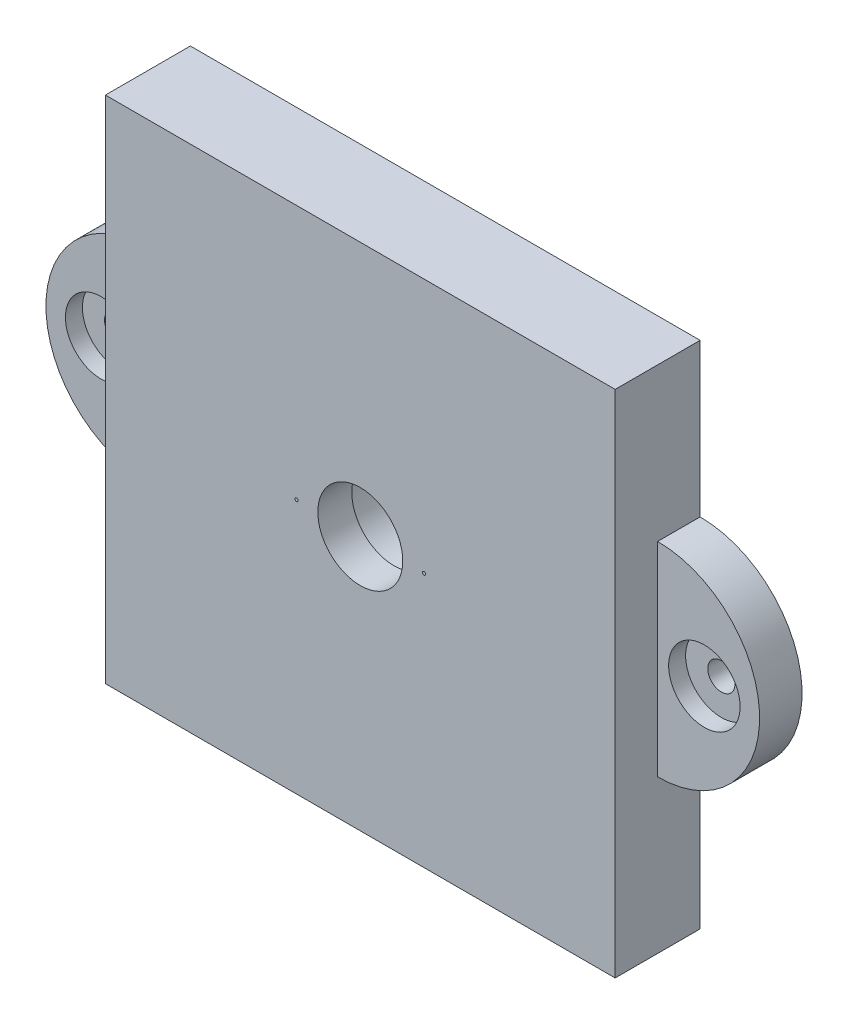
from build123d import *

# Parameters (mm, degrees)
BOSS_EXTRU_1_DEPTH                                = 10
ESQUISSE2_R                                       = 5.000000000000001
ENL_V_MAT_EXTRU_1_DEPTH                           = 59.16945460210114
ENL_V_MAT_EXTRU_5_DEPTH                           = 6
D_GAGEMENT_M3_52_D                                = 3.7
D_GAGEMENT_M3_52_DEPTH                            = 3
D_GAGEMENT_M3_52_TIP                              = 1.1115921452009865
ESQUISSE16_W                                      = 32.38443417416177
ESQUISSE16_H                                      = 29.10998154186418
ENL_V_MAT_EXTRU_6_DEPTH                           = 5
CHAMBRAGE_POUR_VIS_T_TE_HEXAGONALE_M3_D           = 3.2
CHAMBRAGE_POUR_VIS_T_TE_HEXAGONALE_M3_CBORE_D     = 8.412
CHAMBRAGE_POUR_VIS_T_TE_HEXAGONALE_M3_CBORE_DEPTH = 2
SKETCH1_R                                         = 1.8499999999999994
SKETCH1_R_2                                       = 1.8499999999999885
SKETCH1_R_3                                       = 5.5
BOSS_EXTRUDE1_DEPTH                               = 8


with BuildPart() as part:
    # Esquisse1 → Boss.-Extru.1 (new body)
    with BuildSketch(Plane.XY):
        with BuildLine():
            Line((-30.751266961285342, 21.842240344710792), (1.248733038714648, 21.842240344710792))
            Line((1.248733038714648, 21.842240344710792), (29.248733038714647, 21.842240344710792))
            Line((29.248733038714647, 21.842240344710792), (29.24873303871465, 3.8422403447107913))
            ThreePointArc((29.24873303871465, 3.8422403447107913), (41.24873303871465, -8.157759655289208), (29.24873303871465, -20.157759655289208))
            Line((29.24873303871465, -20.157759655289208), (29.248733038714654, -38.15775965528921))
            Line((29.248733038714654, -38.15775965528921), (-30.751266961285342, -38.15775965528921))
            Line((-30.751266961285342, -38.15775965528921), (-30.751266961285346, -20.157759655289208))
            ThreePointArc((-30.751266961285346, -20.157759655289208), (-42.75126696128535, -8.15775965528921), (-30.751266961285346, 3.8422403447107913))
            Line((-30.751266961285346, 3.8422403447107913), (-30.751266961285342, 21.842240344710792))
        make_face()
    extrude(amount=BOSS_EXTRU_1_DEPTH)

    # Esquisse2 → Enlèv. mat.-Extru.1 (cut, through all)
    with BuildSketch(Plane.XY.offset(10)):
        with Locations((-0.7512669612853434, -8.157759655289208)):
            Circle(ESQUISSE2_R)
    extrude(amount=-ENL_V_MAT_EXTRU_1_DEPTH, mode=Mode.SUBTRACT)

    # Esquisse13 → Enlèv. mat.-Extru.5 (cut)
    with BuildSketch(Plane(origin=(0, 0, 0), x_dir=(-1, 0, 0), z_dir=(0, 0, -1))):
        Polygon((-27.248733038714654, 19.842240344710792), (28.751266961285335, 19.842240344710792), (28.751266961285346, -36.15775965528921), (-27.248733038714647, -36.15775965528921), align=None)
    extrude(amount=-ENL_V_MAT_EXTRU_5_DEPTH, mode=Mode.SUBTRACT)

    # Dégagement M3.52
    with Locations(Plane(origin=(0, 0, 6), x_dir=(-1, 0, 0), z_dir=(0, 0, -1))):
        with Locations((8.251266961, -8.157759655), (-6.748733039, -8.157759655)):
            Hole(D_GAGEMENT_M3_52_D / 2, depth=D_GAGEMENT_M3_52_DEPTH)
            with Locations((0, 0, -(D_GAGEMENT_M3_52_DEPTH + D_GAGEMENT_M3_52_TIP / 2))):  # 118° drill point
                Cone(0, D_GAGEMENT_M3_52_D / 2, D_GAGEMENT_M3_52_TIP, mode=Mode.SUBTRACT)

    # Esquisse16 → Enlèv. mat.-Extru.6 (cut)
    with BuildSketch(Plane.XY.offset(10)):
        Polygon((-30.75126696128535, 3.8422403447107913), (-47.0482075621835, 3.8422403447107896), (-47.0482075621835, -23.80458867239539), (-30.75126696128535, -23.804588672395386), align=None)
        with Locations((45.44095012579554, -10.712750426221298)):
            Rectangle(ESQUISSE16_W, ESQUISSE16_H)
    extrude(amount=-ENL_V_MAT_EXTRU_6_DEPTH, mode=Mode.SUBTRACT)

    # Chambrage pour vis à tête hexagonale M3 (Grade A)1 (through all)
    with Locations(Plane.XY.offset(5)):
        with Locations((34.748733039, -8.157759655), (-36.251266961, -8.157759655)):
            CounterBoreHole(CHAMBRAGE_POUR_VIS_T_TE_HEXAGONALE_M3_D / 2, CHAMBRAGE_POUR_VIS_T_TE_HEXAGONALE_M3_CBORE_D / 2, CHAMBRAGE_POUR_VIS_T_TE_HEXAGONALE_M3_CBORE_DEPTH)

    # Sketch1 → Boss-Extrude1 (add)
    with BuildSketch(Plane(origin=(0, 0, 6), x_dir=(-1, 0, 0), z_dir=(0, 0, -1))):
        Polygon((-13.248733038714654, -0.15775965528920868), (-13.248733038714652, -16.157759655289208), (14.751266961285353, -16.157759655289208), (14.751266961285348, -0.15775965528920868), align=None)
        with Locations((-6.748733038714656, -8.15775965528921)):
            Circle(SKETCH1_R, mode=Mode.SUBTRACT)
        with Locations((8.251266961285344, -8.15775965528921)):
            Circle(SKETCH1_R_2, mode=Mode.SUBTRACT)
        with Locations((0.7512669612853434, -8.157759655289208)):
            Circle(SKETCH1_R_3, mode=Mode.SUBTRACT)
    extrude(amount=BOSS_EXTRUDE1_DEPTH)


solid = part.part
